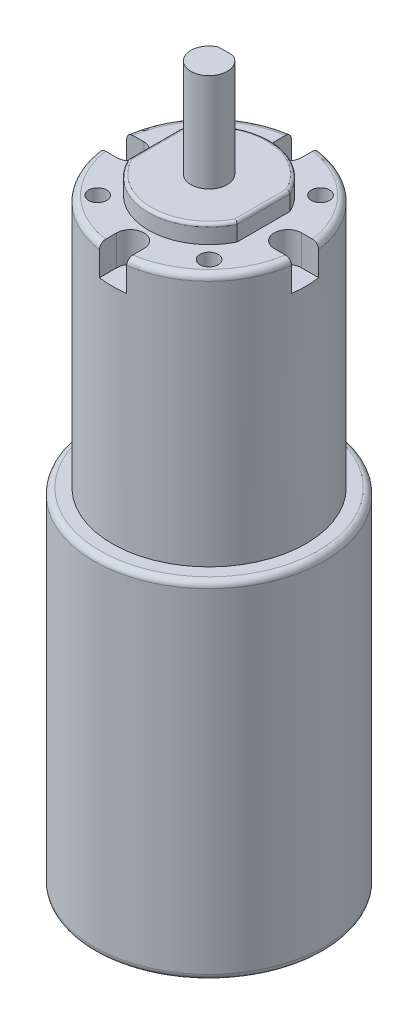
from build123d import *

# Parameters (mm, degrees)
SKETCH3_R           = 3
BOSS_EXTRUDE2_DEPTH = 16.2
CUT_EXTRUDE1_START  = -12
CUT_EXTRUDE1_DEPTH  = 12
BOSS_EXTRUDE3_DEPTH = 3
SKETCH7_R           = 16
BOSS_EXTRUDE4_DEPTH = 41.8
SKETCH8_R           = 19
BOSS_EXTRUDE5_DEPTH = 57.1
FILLET1_R           = 1
FILLET2_R           = 0.5
SKETCH9_R           = 1.5
CUT_EXTRUDE2_DEPTH  = 5
FILLET3_R           = 1


with BuildPart() as part:
    # Sketch3 → Boss-Extrude2 (new body)
    with BuildSketch(Plane(origin=(0, 0, 0), x_dir=(1, 0, 0), z_dir=(0, 1, 0))):
        with Locations(Location((0, 0, 0), (0, 0, 270))):
            Circle(SKETCH3_R)
    extrude(amount=BOSS_EXTRUDE2_DEPTH)

    # Sketch4 → Cut-Extrude1 (cut)
    with BuildSketch(Plane(origin=(0, 16.2, 0), x_dir=(1, 0, 0), z_dir=(0, 1, 0)).offset(CUT_EXTRUDE1_START)):
        with BuildLine():
            Line((-1.198957881, 2.75), (1.198957881, 2.75))
            ThreePointArc((1.198957881, 2.75), (0, 3), (-1.198957881, 2.75))
        make_face()
    extrude(amount=CUT_EXTRUDE1_DEPTH, mode=Mode.SUBTRACT)

    # Sketch5 → Boss-Extrude3 (add)
    with BuildSketch(Plane(origin=(0, 0, 0), x_dir=(1, 0, 0), z_dir=(0, 1, 0))):
        with BuildLine():
            Line((-9, -4.358898944), (-9, 4.358898944))
            ThreePointArc((-9, 4.358898944), (0, 10), (9, 4.358898944))
            Line((9, 4.358898944), (9, -4.358898944))
            ThreePointArc((9, -4.358898944), (0, -10), (-9, -4.358898944))
        make_face()
    extrude(amount=-BOSS_EXTRUDE3_DEPTH)

    # Sketch7 → Boss-Extrude4 (add)
    with BuildSketch(Plane(origin=(0, -3, 0), x_dir=(-1, 0, 0), z_dir=(0, -1, 0))):
        with Locations(Location((0, 0, 0), (0, 0, 90))):
            Circle(SKETCH7_R)
    extrude(amount=BOSS_EXTRUDE4_DEPTH)

    # Sketch8 → Boss-Extrude5 (add)
    with BuildSketch(Plane(origin=(0, -44.8, 0), x_dir=(-1, 0, 0), z_dir=(0, -1, 0))):
        with Locations(Location((0, 0, 0), (0, 0, 90))):
            Circle(SKETCH8_R)
    extrude(amount=BOSS_EXTRUDE5_DEPTH)

    # Fillet1
    fillet1_edges = [part.edges().sort_by_distance(p)[0] for p in [
        (0, -3, 16),
        (0, -44.8, 19),
    ]]
    fillet(fillet1_edges, radius=FILLET1_R)

    # Fillet2
    fillet2_edges = [part.edges().sort_by_distance(p)[0] for p in [
        (0, 0, -10),
        (-9, 0, 0),
        (0, 0, 10),
        (9, 0, 0),
    ]]
    fillet(fillet2_edges, radius=FILLET2_R)

    # Sketch9 → Cut-Extrude2 (cut)
    with BuildSketch(Plane(origin=(0, -3, 0), x_dir=(-1, 0, 0), z_dir=(0, -1, 0))):
        with Locations(Location((9.192388155, -9.192388155, 0), (0, 0, 90))):
            Circle(SKETCH9_R)
        with Locations(Location((-9.192388155, -9.192388155, 0), (0, 0, 90))):
            Circle(SKETCH9_R)
        with Locations(Location((-9.192388155, 9.192388155, 0), (0, 0, 90))):
            Circle(SKETCH9_R)
        with Locations(Location((9.192388155, 9.192388155, 0), (0, 0, 90))):
            Circle(SKETCH9_R)
        with BuildLine():
            Line((-17.5, -2.25), (-17.5, 2.25))
            Line((-17.5, 2.25), (-13, 2.25))
            ThreePointArc((-13, 2.25), (-10.75, 0), (-13, -2.25))
            Line((-13, -2.25), (-17.5, -2.25))
        make_face()
        with BuildLine():
            Line((2.25, -17.5), (-2.25, -17.5))
            Line((-2.25, -17.5), (-2.25, -13))
            ThreePointArc((-2.25, -13), (0, -10.75), (2.25, -13))
            Line((2.25, -13), (2.25, -17.5))
        make_face()
        with BuildLine():
            Line((-2.25, 17.5), (2.25, 17.5))
            Line((2.25, 17.5), (2.25, 13))
            ThreePointArc((2.25, 13), (0, 10.75), (-2.25, 13))
            Line((-2.25, 13), (-2.25, 17.5))
        make_face()
        with BuildLine():
            Line((17.5, 2.25), (17.5, -2.25))
            Line((17.5, -2.25), (13, -2.25))
            ThreePointArc((13, -2.25), (10.75, 0), (13, 2.25))
            Line((13, 2.25), (17.5, 2.25))
        make_face()
    extrude(amount=CUT_EXTRUDE2_DEPTH, mode=Mode.SUBTRACT)

    # Fillet3
    fillet3_edges = [part.edges().sort_by_distance(p)[0] for p in [
        (0, -101.9, 19),
    ]]
    fillet(fillet3_edges, radius=FILLET3_R)


solid = part.part
